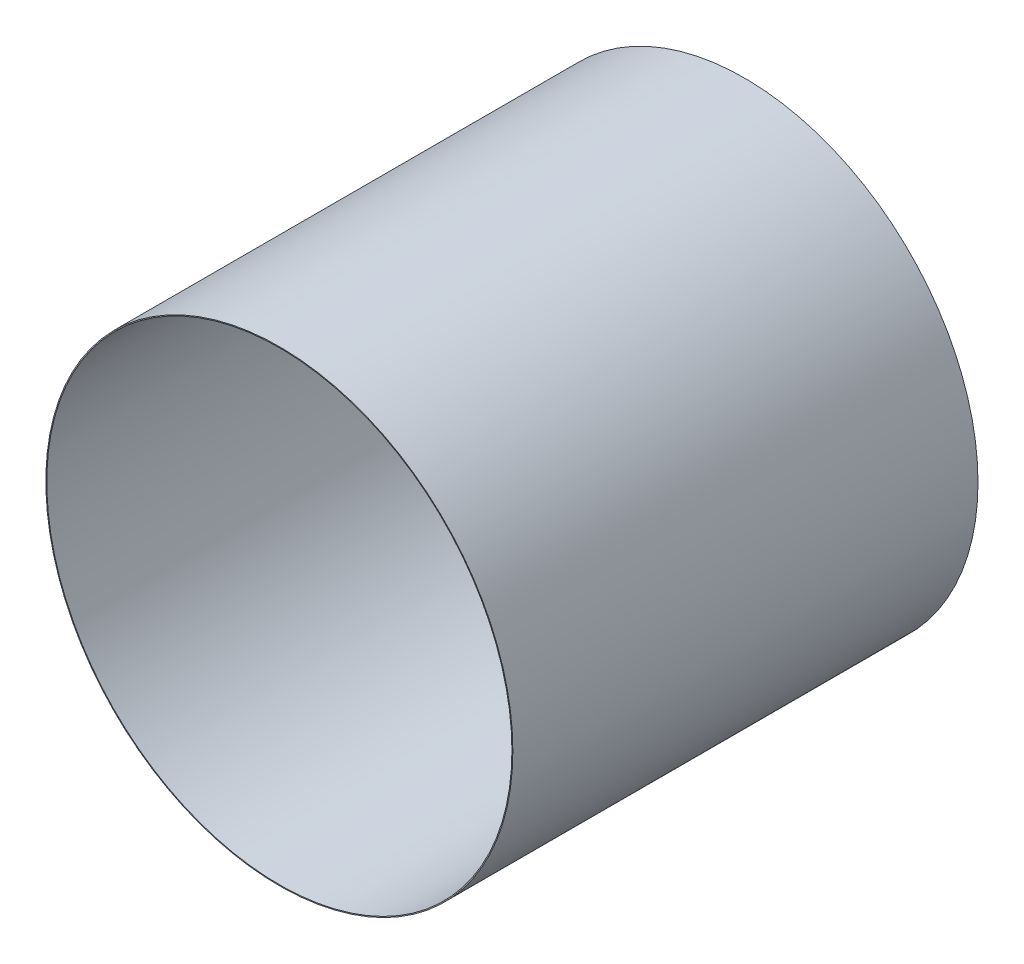
from build123d import *

# Parameters (mm, degrees)
SKETCH1_R           = 12.55
SKETCH1_R_2         = 12.5
BOSS_EXTRUDE1_DEPTH = 25


with BuildPart() as part:
    # Sketch1 → Boss-Extrude1 (new body)
    with BuildSketch(Plane.XY):
        Circle(SKETCH1_R)
        Circle(SKETCH1_R_2, mode=Mode.SUBTRACT)
    extrude(amount=BOSS_EXTRUDE1_DEPTH)


solid = part.part
